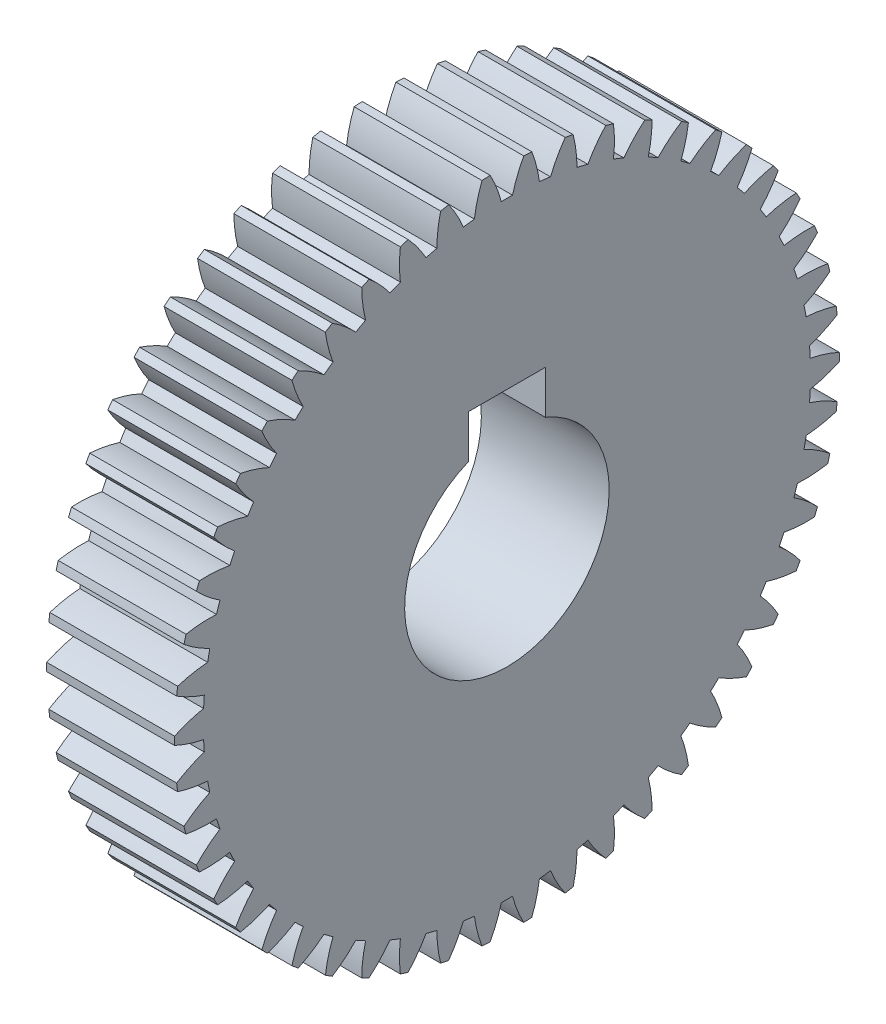
from build123d import *

# Parameters (mm, degrees)
BASPROSKE_W     = 5
BASPROSKE_H     = 13
TOOTHCUT_DEPTH  = 20.052558883
TEETHCUTS_COUNT = 50
TEETHCUTS_ANGLE = 352.8
BORSKE_R        = 4
BORE_DEPTH      = 50.0000508
KEYSKE_W        = 3
KEYSKE_H        = 5.4
KEYWAY_DEPTH    = 50.0000508


with BuildPart() as part:
    # BasProSke → Base-Revolve (revolve)
    with BuildSketch(Plane(origin=(0, 0, 0), x_dir=(1, 0, 0), z_dir=(0, 1, 0)), mode=Mode.PRIVATE) as base_revolve_sk:
        with Locations((2.5, 6.5)):
            Rectangle(BASPROSKE_W, BASPROSKE_H)
    revolve(base_revolve_sk.sketch.rotate(Axis((-10, 0, 0), (1, 0, 0)), 180), axis=Axis((-10, 0, 0), (1, 0, 0)))

    # TooCutSke → ToothCut (cut, through all)
    with BuildSketch(Plane(origin=(0, 0, 0), x_dir=(0, 0, -1), z_dir=(1, 0, 0))):
        with BuildLine():
            ThreePointArc((0.218701072, 11.871985758), (0, 11.874), (-0.218701072, 11.871985758))
            ThreePointArc((-0.218701072, 11.871985758), (-0.410224227, 12.453928998), (-0.671481128, 13.008080498))
            ThreePointArc((-0.671481128, 13.008080498), (0, 13.0254), (0.671481128, 13.008080498))
            ThreePointArc((0.671481128, 13.008080498), (0.410224227, 12.453928998), (0.218701072, 11.871985758))
        make_face()
    toothcut = extrude(amount=TOOTHCUT_DEPTH, mode=Mode.SUBTRACT)

    # TeethCuts: ToothCut ×50 about axis
    teethcuts_axis = Axis((-10, 0, 0), (1, 0, 0))
    for i in range(1, TEETHCUTS_COUNT):
        add(toothcut.rotate(teethcuts_axis, i * TEETHCUTS_ANGLE / (TEETHCUTS_COUNT - 1)), mode=Mode.SUBTRACT)

    # BorSke → Bore (cut, symmetric)
    with BuildSketch(Plane(origin=(0, 0, 0), x_dir=(0, 0, -1), z_dir=(1, 0, 0))):
        with Locations(Location((0, 0, 0), (0, 0, 180))):
            Circle(BORSKE_R)
    extrude(amount=BORE_DEPTH, both=True, mode=Mode.SUBTRACT)

    # KeySke → Keyway (cut, symmetric)
    with BuildSketch(Plane(origin=(0, 0, 0), x_dir=(0, 0, -1), z_dir=(1, 0, 0))):
        with Locations((0, 2.7)):
            Rectangle(KEYSKE_W, KEYSKE_H)
    extrude(amount=KEYWAY_DEPTH, both=True, mode=Mode.SUBTRACT)


solid = part.part
